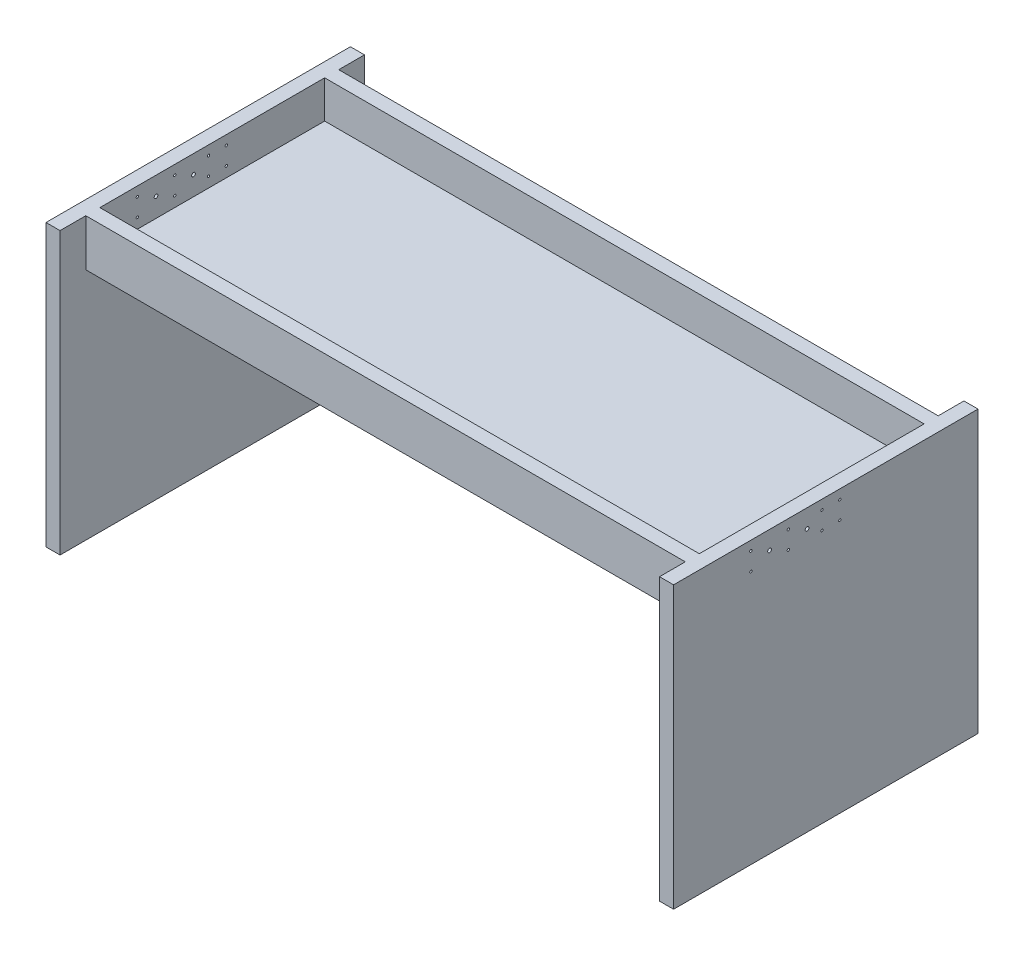
from build123d import *

# Parameters (mm, degrees)
SKETCH1_W           = 1340
SKETCH1_H           = 540
BOSS_EXTRUDE1_DEPTH = 100
SKETCH2_W           = 1280
SKETCH2_H           = 480
CUT_EXTRUDE1_DEPTH  = 80
SKETCH6_W           = 650
SKETCH6_H           = 600
BOSS_EXTRUDE3_DEPTH = 30
SKETCH10_R          = 2.5
CUT_EXTRUDE3_DEPTH  = 80
SKETCH11_R          = 4
CUT_EXTRUDE4_DEPTH  = 80


with BuildPart() as part:
    # Sketch1 → Boss-Extrude1 (new body)
    with BuildSketch(Plane(origin=(0, 0, 0), x_dir=(1, 0, 0), z_dir=(0, 1, 0))):
        Rectangle(SKETCH1_W, SKETCH1_H)
    extrude(amount=BOSS_EXTRUDE1_DEPTH)

    # Sketch2 → Cut-Extrude1 (cut)
    with BuildSketch(Plane(origin=(0, 100, 0), x_dir=(1, 0, 0), z_dir=(0, 1, 0))):
        Rectangle(SKETCH2_W, SKETCH2_H)
    extrude(amount=-CUT_EXTRUDE1_DEPTH, mode=Mode.SUBTRACT)

    # Sketch6 → Boss-Extrude3 (add)
    with BuildSketch(Plane(origin=(-640, 0, 0), x_dir=(0, 0, -1), z_dir=(1, 0, 0))):
        with Locations((0, -200)):
            Rectangle(SKETCH6_W, SKETCH6_H)
    boss_extrude3 = extrude(amount=-BOSS_EXTRUDE3_DEPTH)

    # Mirror3: Boss-Extrude3 across plane
    add(boss_extrude3.mirror(Plane(origin=(0, 0, 0), x_dir=(0, 0, 1), z_dir=(1, 0, 0))))

    # Sketch10 → Cut-Extrude3 (cut)
    with BuildSketch(Plane(origin=(-640, 0, 0), x_dir=(0, 0, -1), z_dir=(1, 0, 0))):
        with Locations((-160, 80)):
            Circle(SKETCH10_R)
        with Locations((-160, 42)):
            Circle(SKETCH10_R)
        with Locations((-80, 42)):
            Circle(SKETCH10_R)
        with Locations((-80, 80)):
            Circle(SKETCH10_R)
        with Locations((30, 80)):
            Circle(SKETCH10_R)
        with Locations((30, 42)):
            Circle(SKETCH10_R)
        with Locations((-8, 42)):
            Circle(SKETCH10_R)
        with Locations((-8, 80)):
            Circle(SKETCH10_R)
    cut_extrude3 = extrude(amount=-CUT_EXTRUDE3_DEPTH, mode=Mode.SUBTRACT)

    # Mirror4: Cut-Extrude3 across plane
    add(cut_extrude3.mirror(Plane(origin=(0, 0, 0), x_dir=(0, 0, 1), z_dir=(1, 0, 0))), mode=Mode.SUBTRACT)

    # Sketch11 → Cut-Extrude4 (cut)
    with BuildSketch(Plane(origin=(-640, 0, 0), x_dir=(0, 0, -1), z_dir=(1, 0, 0))):
        with Locations((-40, 61)):
            Circle(SKETCH11_R)
        with Locations((-120, 61)):
            Circle(SKETCH11_R)
    cut_extrude4 = extrude(amount=-CUT_EXTRUDE4_DEPTH, mode=Mode.SUBTRACT)

    # Mirror5: Cut-Extrude4 across plane
    add(cut_extrude4.mirror(Plane(origin=(0, 0, 0), x_dir=(0, 0, 1), z_dir=(1, 0, 0))), mode=Mode.SUBTRACT)


solid = part.part
